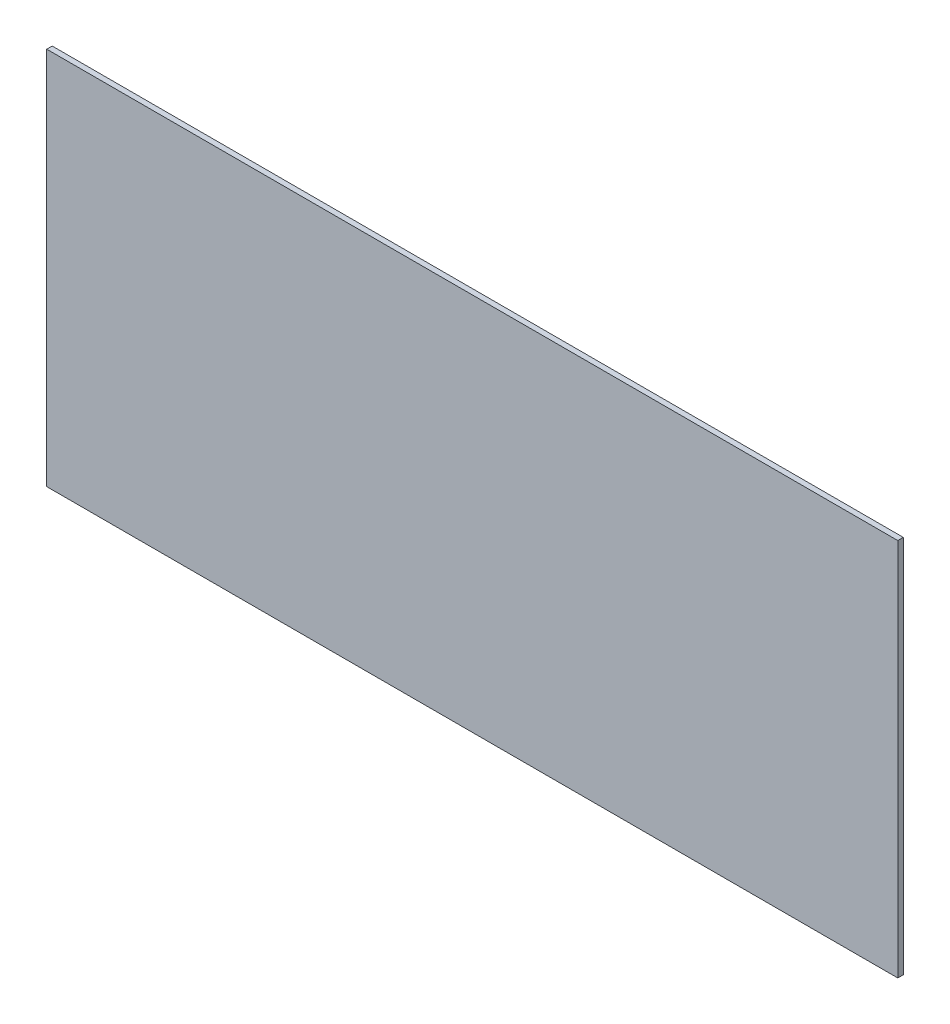
from build123d import *

# Parameters (mm, degrees)
SKETCH1_W           = 984.25
SKETCH1_H           = 438.15
BOSS_EXTRUDE1_DEPTH = 6.35


with BuildPart() as part:
    # Sketch1 → Boss-Extrude1 (new body)
    with BuildSketch(Plane.XY):
        with Locations((492.125, 219.075)):
            Rectangle(SKETCH1_W, SKETCH1_H)
    extrude(amount=BOSS_EXTRUDE1_DEPTH)


solid = part.part
